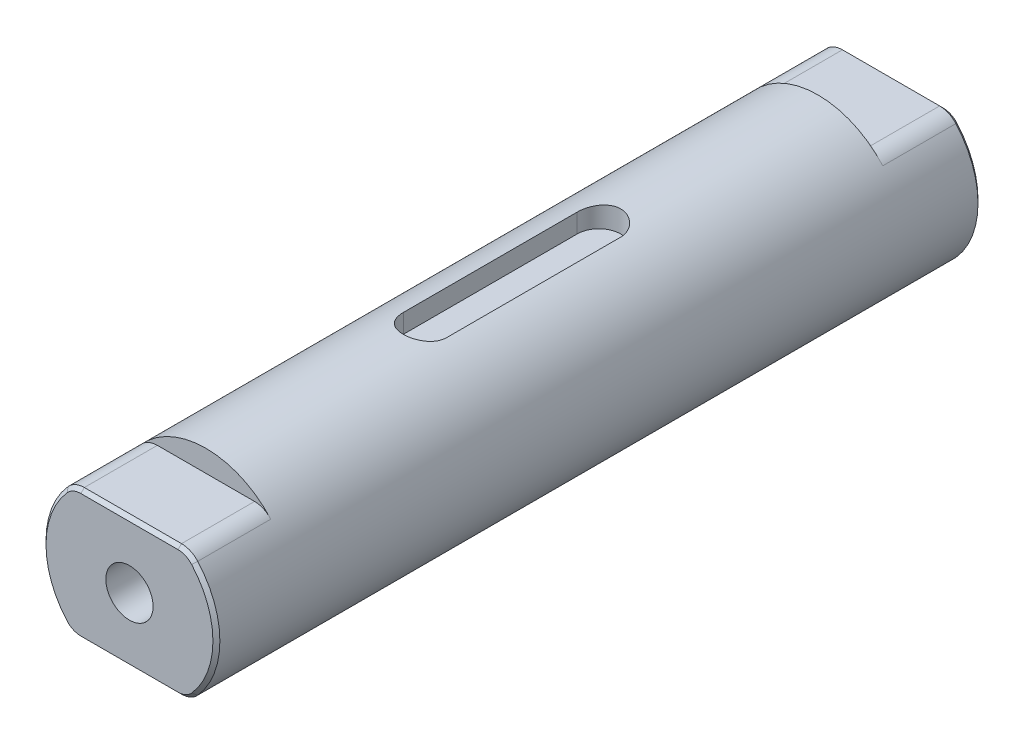
from build123d import *

# Parameters (mm, degrees)
SKETCH1_W                 = 55.88
SKETCH1_H                 = 6.35
CUT_EXTRUDE1_START        = -5.588
CUT_EXTRUDE1_DEPTH        = 5.588
CUT_EXTRUDE2_DEPTH        = 5.588
F_8_32_TAPPED_HOLE1_D     = 3.4544
F_8_32_TAPPED_HOLE1_DEPTH = 12.7
F_8_32_TAPPED_HOLE1_TIP   = 1.037806461
F_8_32_TAPPED_HOLE2_D     = 3.4544
F_8_32_TAPPED_HOLE2_DEPTH = 12.7
F_8_32_TAPPED_HOLE2_TIP   = 1.037806461
FILLET1_R                 = 1.5875
CHAMFER1_SIZE             = 0.254
CUT_EXTRUDE3_DEPTH        = 1.5875


with BuildPart() as part:
    # Sketch1 → Revolve1 (revolve)
    with BuildSketch(Plane(origin=(0, 0, 0), x_dir=(0, 0, -1), z_dir=(1, 0, 0)), mode=Mode.PRIVATE) as revolve1_sk:
        with Locations((27.94, 3.175)):
            Rectangle(SKETCH1_W, SKETCH1_H)
    revolve(revolve1_sk.sketch.rotate(Axis((0, 0, 0), (0, 0, -1)), 90), axis=Axis((0, 0, 0), (0, 0, -1)))

    # Sketch5 → Cut-Extrude1 (cut)
    with BuildSketch(Plane.XY.offset(CUT_EXTRUDE1_START)):
        with BuildLine():
            Line((-4.200130206, 4.7625), (4.200130206, 4.7625))
            ThreePointArc((4.200130206, 4.7625), (0, 6.35), (-4.200130206, 4.7625))
        make_face()
        with BuildLine():
            Line((-4.200130206, -4.7625), (4.200130206, -4.7625))
            ThreePointArc((4.200130206, -4.7625), (0, -6.35), (-4.200130206, -4.7625))
        make_face()
    extrude(amount=CUT_EXTRUDE1_DEPTH, mode=Mode.SUBTRACT)

    # Sketch6 → Cut-Extrude2 (cut)
    with BuildSketch(Plane(origin=(0, 0, -55.88), x_dir=(-1, 0, 0), z_dir=(0, 0, -1))):
        with BuildLine():
            Line((-4.200130206, 4.7625), (4.200130206, 4.7625))
            ThreePointArc((4.200130206, 4.7625), (0, 6.35), (-4.200130206, 4.7625))
        make_face()
        with BuildLine():
            Line((4.200130206, -4.7625), (-4.200130206, -4.7625))
            ThreePointArc((-4.200130206, -4.7625), (0, -6.35), (4.200130206, -4.7625))
        make_face()
    extrude(amount=-CUT_EXTRUDE2_DEPTH, mode=Mode.SUBTRACT)

    # #8-32 Tapped Hole1
    with Locations(Plane.XY):
        with Locations((0, 0)):
            Hole(F_8_32_TAPPED_HOLE1_D / 2, depth=F_8_32_TAPPED_HOLE1_DEPTH)
            with Locations((0, 0, -(F_8_32_TAPPED_HOLE1_DEPTH + F_8_32_TAPPED_HOLE1_TIP / 2))):  # 118° drill point
                Cone(0, F_8_32_TAPPED_HOLE1_D / 2, F_8_32_TAPPED_HOLE1_TIP, mode=Mode.SUBTRACT)

    # #8-32 Tapped Hole2
    with Locations(Plane(origin=(0, 0, -55.88), x_dir=(-1, 0, 0), z_dir=(0, 0, -1))):
        with Locations((0, 0)):
            Hole(F_8_32_TAPPED_HOLE2_D / 2, depth=F_8_32_TAPPED_HOLE2_DEPTH)
            with Locations((0, 0, -(F_8_32_TAPPED_HOLE2_DEPTH + F_8_32_TAPPED_HOLE2_TIP / 2))):  # 118° drill point
                Cone(0, F_8_32_TAPPED_HOLE2_D / 2, F_8_32_TAPPED_HOLE2_TIP, mode=Mode.SUBTRACT)

    # Fillet1
    fillet1_edges = [part.edges().sort_by_distance(p)[0] for p in [
        (-4.200130206, 4.7625, -2.794),
        (4.200130206, 4.7625, -2.794),
        (4.200130206, -4.7625, -2.794),
        (-4.200130206, -4.7625, -2.794),
        (4.200130206, 4.7625, -53.086),
        (-4.200130206, 4.7625, -53.086),
        (-4.200130206, -4.7625, -53.086),
        (4.200130206, -4.7625, -53.086),
    ]]
    fillet(fillet1_edges, radius=FILLET1_R)

    # Chamfer1
    chamfer1_edges = [part.edges().sort_by_distance(p)[0] for p in [
        (-6.35, 0, -55.88),
        (5.931994479, -2.26582027, -55.88),
        (-6.35, 0, 0),
        (5.931994479, -2.26582027, 0),
        (0, -4.7625, 0),
        (0, 4.7625, 0),
        (-4.197852075, 4.6241826, 0),
        (4.197852075, 4.6241826, 0),
        (4.197852075, -4.6241826, 0),
        (-4.197852075, -4.6241826, 0),
        (0, -4.7625, -55.88),
        (0, 4.7625, -55.88),
        (4.197852075, 4.6241826, -55.88),
        (-4.197852075, 4.6241826, -55.88),
        (4.197852075, -4.6241826, -55.88),
        (-4.197852075, -4.6241826, -55.88),
    ]]
    chamfer(chamfer1_edges, length=CHAMFER1_SIZE)

    # Sketch11 → Cut-Extrude3 (cut)
    with BuildSketch(Plane(origin=(0, 6.35, 0), x_dir=(-1, 0, 0), z_dir=(0, 1, 0))):
        with BuildLine():
            Line((-1.5875, -34.29), (-1.5875, -21.59))
            ThreePointArc((-1.5875, -21.59), (0, -20.0025), (1.5875, -21.59))
            Line((1.5875, -21.59), (1.5875, -34.29))
            ThreePointArc((1.5875, -34.29), (0, -35.8775), (-1.5875, -34.29))
        make_face()
    extrude(amount=-CUT_EXTRUDE3_DEPTH, mode=Mode.SUBTRACT)


solid = part.part
